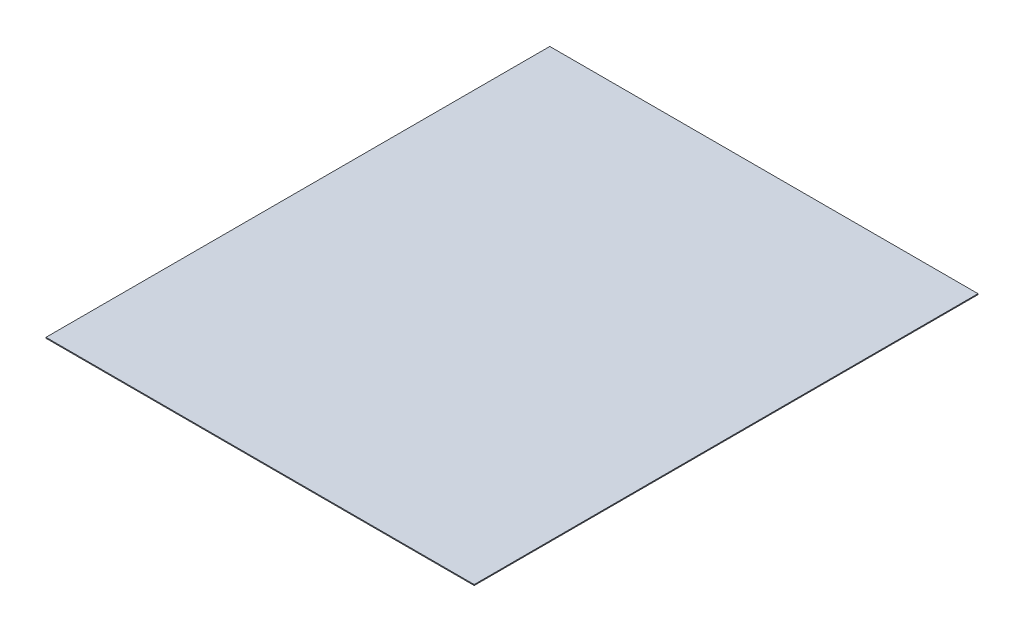
from build123d import *

# Parameters (mm, degrees)
SKETCH1_W            = 697
SKETCH1_H            = 1.5
PACK_DIS_UST_1_DEPTH = 820


with BuildPart() as part:
    # Sketch1 → PACK_dis_ust_1 (new body)
    with BuildSketch(Plane.XY):
        with Locations((350, 1969.25)):
            Rectangle(SKETCH1_W, SKETCH1_H)
    extrude(amount=-PACK_DIS_UST_1_DEPTH)


solid = part.part
